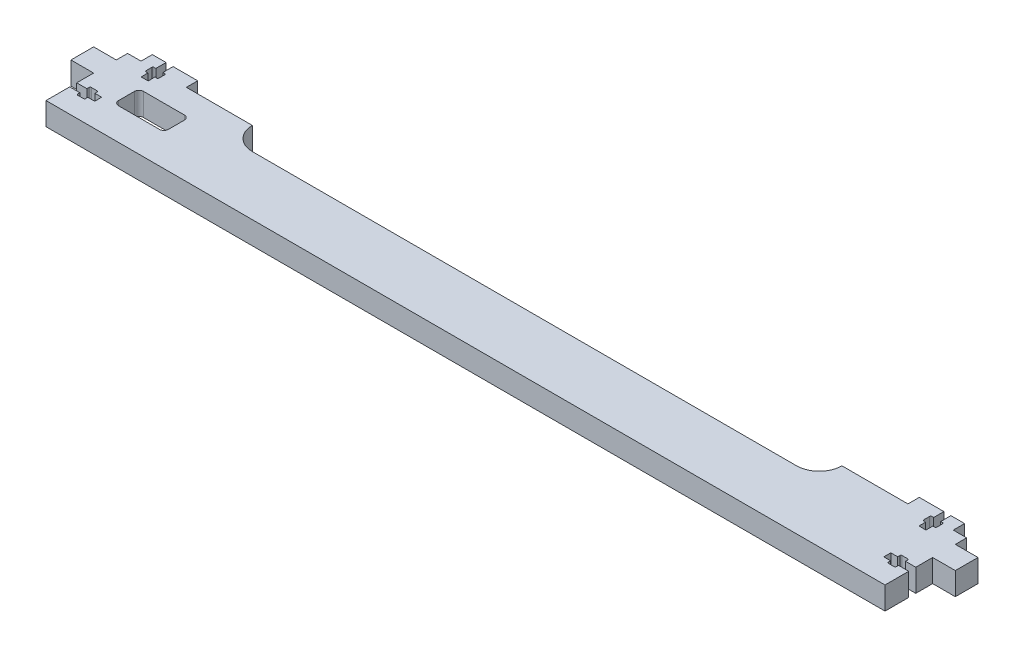
from build123d import *

# Parameters (mm, degrees)
MAINSHAPE_DEPTH      = 10
SKETCH15_W           = 20
SKETCH15_H           = 10
BOSS_EXTRUDE4_DEPTH  = 10
SCREWSLOTS_DEPTH     = 197.606205395
LCDCABLECUTOUT_DEPTH = 197.606205395
CUT_EXTRUDE5_DEPTH   = 197.606205395


with BuildPart() as part:
    # Sketch1 → MainShape (new body)
    with BuildSketch(Plane(origin=(0, 0, 0), x_dir=(1, 0, 0), z_dir=(0, 1, 0))):
        Polygon((-185, 18), (0, 18), (0, -18), (-185, -18), (-185, 3), (-195, 3), (-195, 13), (-185, 13), align=None)
    mainshape = extrude(amount=MAINSHAPE_DEPTH)

    # Sketch15 → Boss-Extrude4 (add, through all)
    with BuildSketch(Plane(origin=(0, 10, 0), x_dir=(1, 0, 0), z_dir=(0, 1, 0))):
        with Locations((-169.1, 18)):
            Rectangle(SKETCH15_W, SKETCH15_H)
    boss_extrude4 = extrude(amount=-BOSS_EXTRUDE4_DEPTH)

    # Sketch2 → ScrewSlots (cut, through all)
    with BuildSketch(Plane(origin=(0, 10, 0), x_dir=(1, 0, 0), z_dir=(0, 1, 0))):
        with BuildLine():
            Line((-173.05, 23), (-173.05, 18.5))
            Line((-173.05, 18.5), (-173.85, 18.5))
            ThreePointArc((-173.85, 18.5), (-174.203553391, 18.353553391), (-174.35, 18))
            Line((-174.35, 18), (-174.35, 15.5))
            ThreePointArc((-174.35, 15.5), (-174.203553391, 15.146446609), (-173.85, 15))
            Line((-173.85, 15), (-173.05, 15))
            Line((-173.05, 15), (-173.05, 12))
            Line((-173.05, 12), (-169.95, 12))
            Line((-169.95, 12), (-169.95, 15))
            Line((-169.95, 15), (-169.15, 15))
            ThreePointArc((-169.15, 15), (-168.796446609, 15.146446609), (-168.65, 15.5))
            Line((-168.65, 15.5), (-168.65, 18))
            ThreePointArc((-168.65, 18), (-168.796446609, 18.353553391), (-169.15, 18.5))
            Line((-169.15, 18.5), (-169.95, 18.5))
            Line((-169.95, 18.5), (-169.95, 23))
            Line((-169.95, 23), (-173.05, 23))
        make_face()
        with BuildLine():
            Line((-174, -7.55), (-174, -4.45))
            Line((-174, -4.45), (-177, -4.45))
            Line((-177, -4.45), (-177, -3.5))
            ThreePointArc((-177, -3.5), (-177.146446609, -3.146446609), (-177.5, -3))
            Line((-177.5, -3), (-180, -3))
            ThreePointArc((-180, -3), (-180.353553391, -3.146446609), (-180.5, -3.5))
            Line((-180.5, -3.5), (-180.5, -4.45))
            Line((-180.5, -4.45), (-185, -4.45))
            Line((-185, -4.45), (-185, -7.55))
            Line((-185, -7.55), (-180.5, -7.55))
            Line((-180.5, -7.55), (-180.5, -8.5))
            ThreePointArc((-180.5, -8.5), (-180.353553391, -8.853553391), (-180, -9))
            Line((-180, -9), (-177.5, -9))
            ThreePointArc((-177.5, -9), (-177.146446609, -8.853553391), (-177, -8.5))
            Line((-177, -8.5), (-177, -7.55))
            Line((-177, -7.55), (-174, -7.55))
        make_face()
    screwslots = extrude(amount=-SCREWSLOTS_DEPTH, mode=Mode.SUBTRACT)

    # Mirror1: MainShape, Boss-Extrude4, ScrewSlots across plane
    add(mainshape.mirror(Plane(origin=(0, 0, 0), x_dir=(0, 0, 1), z_dir=(1, 0, 0))))
    add(boss_extrude4.mirror(Plane(origin=(0, 0, 0), x_dir=(0, 0, 1), z_dir=(1, 0, 0))))
    add(screwslots.mirror(Plane(origin=(0, 0, 0), x_dir=(0, 0, 1), z_dir=(1, 0, 0))), mode=Mode.SUBTRACT)

    # Sketch11 → LCDCableCutout (cut, through all)
    with BuildSketch(Plane.XZ):
        with BuildLine():
            Line((-149, -7), (-167, -7))
            ThreePointArc((-167, -7), (-168.414213562, -6.414213562), (-169, -5))
            Line((-169, -5), (-169, 2))
            ThreePointArc((-169, 2), (-168.414213562, 3.414213562), (-167, 4))
            Line((-167, 4), (-149, 4))
            ThreePointArc((-149, 4), (-147.585786438, 3.414213562), (-147, 2))
            Line((-147, 2), (-147, -5))
            ThreePointArc((-147, -5), (-147.585786438, -6.414213562), (-149, -7))
        make_face()
    extrude(amount=-LCDCABLECUTOUT_DEPTH, mode=Mode.SUBTRACT)

    # Sketch13 → Cut-Extrude5 (cut, through all)
    with BuildSketch(Plane(origin=(0, 10, 0), x_dir=(1, 0, 0), z_dir=(0, 1, 0))):
        with BuildLine():
            Line((120, 8), (-120, 8))
            ThreePointArc((-120, 8), (-130, 18), (-120, 28))
            Line((-120, 28), (120, 28))
            ThreePointArc((120, 28), (130, 18), (120, 8))
        make_face()
    extrude(amount=-CUT_EXTRUDE5_DEPTH, mode=Mode.SUBTRACT)


solid = part.part
